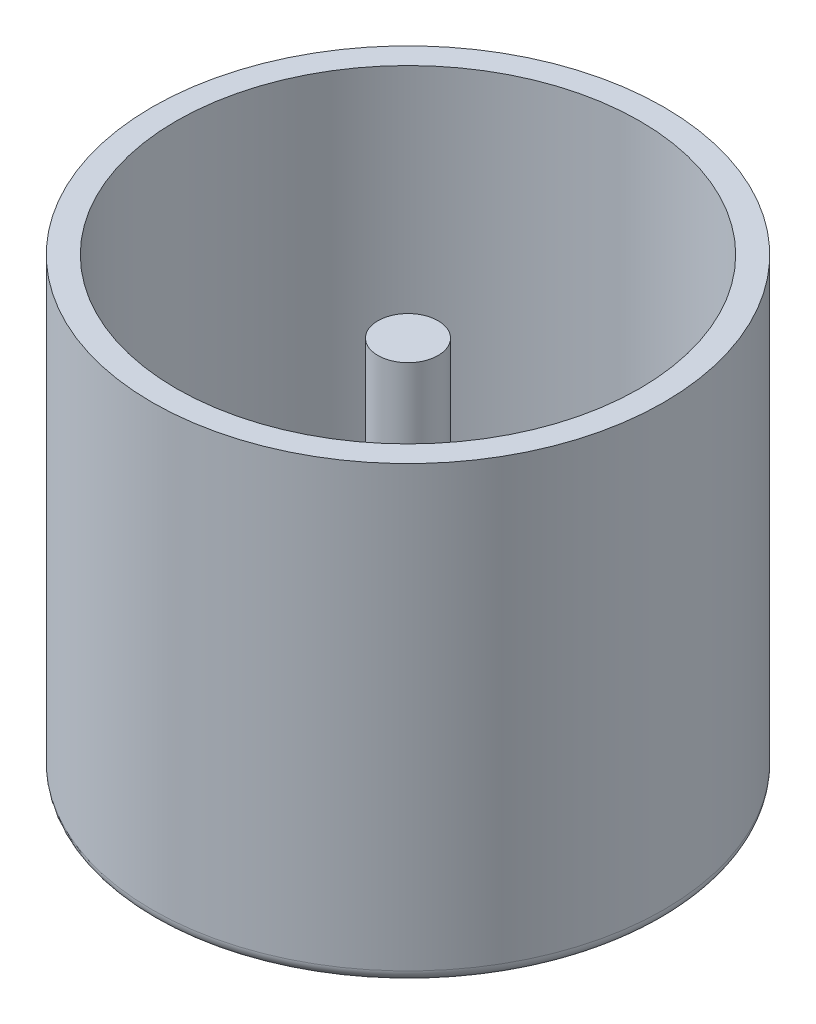
from build123d import *

# Parameters (mm, degrees)
SKETCH1_R           = 53.975
BOSS_EXTRUDE1_DEPTH = 95.25
SHELL1_T            = -5.08
SKETCH2_R           = 6.35
BOSS_EXTRUDE2_DEPTH = 74.93
FILLET1_R           = 2.54


with BuildPart() as part:
    # Sketch1 → Boss-Extrude1 (new body)
    with BuildSketch(Plane(origin=(0, 0, 0), x_dir=(1, 0, 0), z_dir=(0, 1, 0))):
        Circle(SKETCH1_R)
    extrude(amount=BOSS_EXTRUDE1_DEPTH)

    # Shell1
    shell1_openings = [part.faces().sort_by_distance(p)[0] for p in [
        (0, 95.25, 0),
    ]]
    offset(amount=SHELL1_T, openings=shell1_openings, kind=Kind.INTERSECTION)

    # Sketch2 → Boss-Extrude2 (add)
    with BuildSketch(Plane(origin=(0, 5.08, 0), x_dir=(1, 0, 0), z_dir=(0, 1, 0))):
        Circle(SKETCH2_R)
    extrude(amount=BOSS_EXTRUDE2_DEPTH)

    # Fillet1
    fillet1_edges = [part.edges().sort_by_distance(p)[0] for p in [
        (-53.975, 0, 0),
    ]]
    fillet(fillet1_edges, radius=FILLET1_R)


solid = part.part
